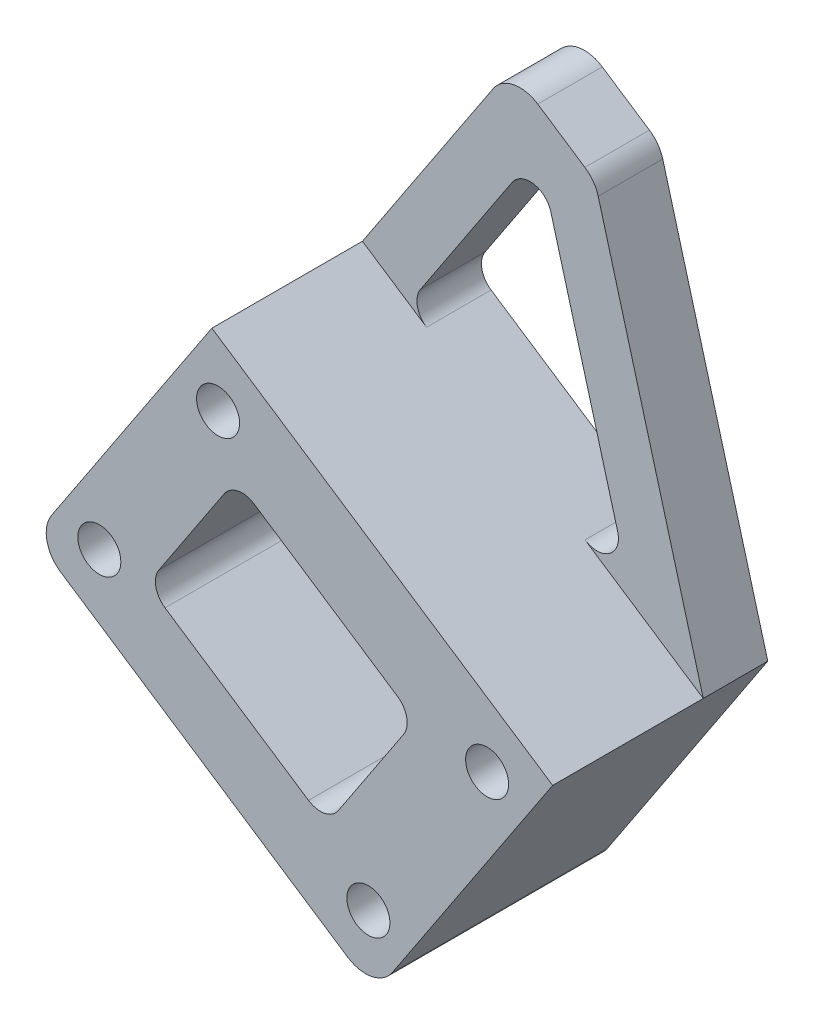
from build123d import *

# Parameters (mm, degrees)
SKETCH_1_R          = 2
EXTRUDE_1_DEPTH     = 20
CUT_EXTRUDE_2_DEPTH = 14


with BuildPart() as part:
    # 草图1 → 凸台-拉伸1 (new body)
    with BuildSketch(Plane.XY):
        with BuildLine():
            Line((8.641852584, -30.917005362), (23.544151188, -8.402088166))
            Line((23.544151188, -8.402088166), (13.777542747, 27.154145307))
            ThreePointArc((13.777542747, 27.154145307), (13.313905715, 28.119907916), (12.540501442, 28.861192305))
            Line((12.540501442, 28.861192305), (8.156572048, 31.762851872))
            ThreePointArc((8.156572048, 31.762851872), (5.902657289, 32.20096852), (3.999103626, 30.917005362))
            Line((3.999103626, 30.917005362), (-23.045808654, -9.94339992))
            ThreePointArc((-23.045808654, -9.94339992), (-23.483925302, -12.197314679), (-22.199962144, -14.100868342))
            Line((-22.199962144, -14.100868342), (4.484384162, -31.762851872))
            ThreePointArc((4.484384162, -31.762851872), (6.738298922, -32.20096852), (8.641852584, -30.917005362))
        make_face()
        with Locations((6.410183267, -27.041485776)):
            Circle(SKETCH_1_R, mode=Mode.SUBTRACT)
        with Locations((17.448922973, -10.363769335)):
            Circle(SKETCH_1_R, mode=Mode.SUBTRACT)
        with Locations((-18.606391395, -10.483376217)):
            Circle(SKETCH_1_R, mode=Mode.SUBTRACT)
        with Locations((-7.567651689, 6.194340225)):
            Circle(SKETCH_1_R, mode=Mode.SUBTRACT)
        with BuildLine():
            Line((3.614616276, -20.394320576), (9.685923114, -11.221576533))
            ThreePointArc((9.685923114, -11.221576533), (9.978000879, -9.718966694), (9.122025441, -8.449930919))
            Line((9.122025441, -8.449930919), (-4.220147712, 0.381060846))
            ThreePointArc((-4.220147712, 0.381060846), (-5.722757552, 0.673138612), (-6.991793327, -0.182836827))
            Line((-6.991793327, -0.182836827), (-13.063100166, -9.35558087))
            ThreePointArc((-13.063100166, -9.35558087), (-13.355177931, -10.858190709), (-12.499202492, -12.127226485))
            Line((-12.499202492, -12.127226485), (0.842970661, -20.95821825))
            ThreePointArc((0.842970661, -20.95821825), (2.3455805, -21.250296015), (3.614616276, -20.394320576))
        make_face(mode=Mode.SUBTRACT)
        with BuildLine():
            Line((-2.181398369, 8.62528164), (12.553966944, -1.1278439))
            ThreePointArc((12.553966944, -1.1278439), (14.831422966, -1.079549075), (15.586409089, 1.069668056))
            Line((15.586409089, 1.069668056), (9.371464219, 23.695744666))
            ThreePointArc((9.371464219, 23.695744666), (7.758191259, 25.140995222), (5.775124401, 24.269878325))
            Line((5.775124401, 24.269878325), (-2.745296043, 11.396927255))
            ThreePointArc((-2.745296043, 11.396927255), (-3.037373808, 9.894317415), (-2.181398369, 8.62528164))
        make_face(mode=Mode.SUBTRACT)
    extrude(amount=EXTRUDE_1_DEPTH)

    # 草图2 → 切除-拉伸2 (cut)
    with BuildSketch(Plane.XY.offset(20)):
        Polygon((23.544151188, -8.402088166), (-8.143510051, 12.571517276), (4.702402911, 35.561922015), (37.191732114, 19.156948223), align=None)
    extrude(amount=-CUT_EXTRUDE_2_DEPTH, mode=Mode.SUBTRACT)


solid = part.part
